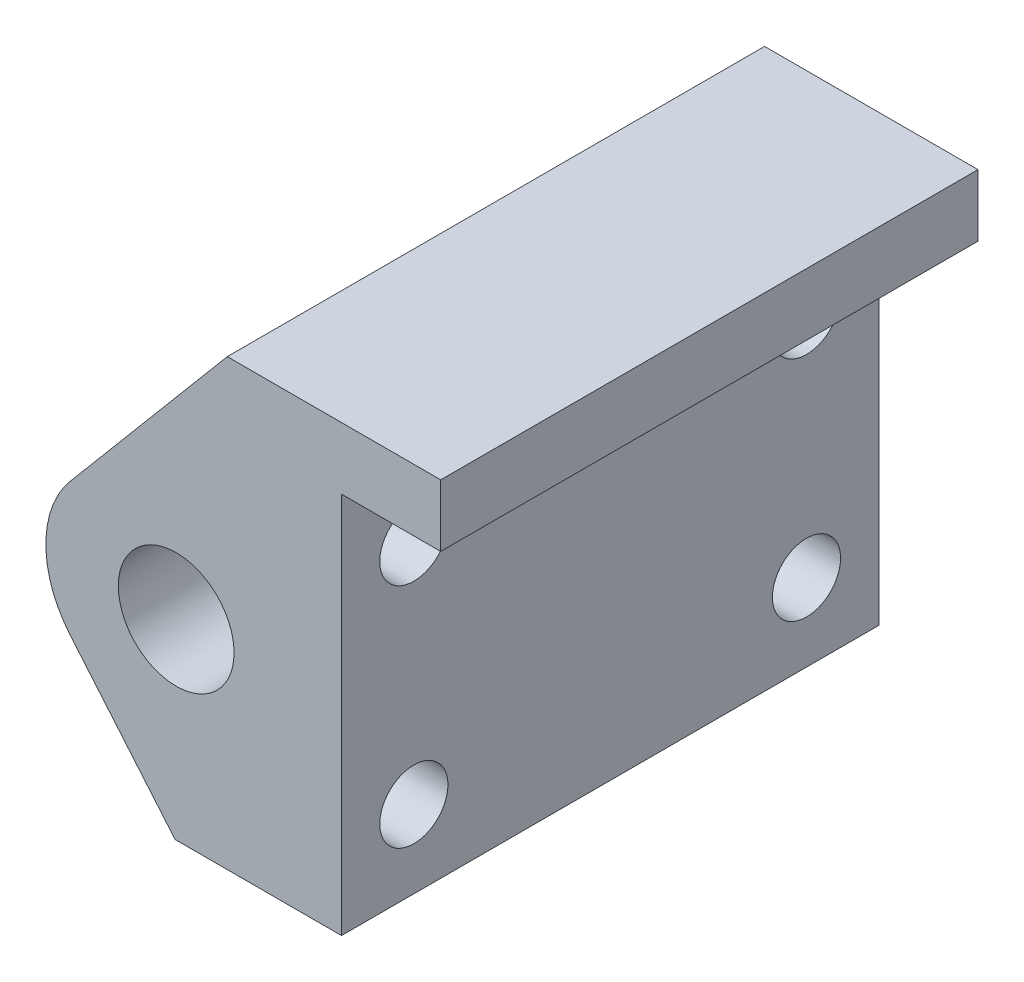
from build123d import *

# Parameters (mm, degrees)
SKETCH_1_R             = 2.8
EXTRUDE_1_DEPTH        = 26
SKETCH_2_R             = 1.65
CUT_EXTRUDE_2_DEPTH    = 43.555295324
CUT_EXTRUDE_2120_REACH = 46.4
SKETCH_4_W             = 26
SKETCH_4_H             = 3
CUT_EXTRUDE_3_REACH    = 44.395
SKETCH_7_W             = 26
SKETCH_7_H             = 3


with BuildPart() as part:
    # 草图1 → 凸台-拉伸1 (new body)
    with BuildSketch(Plane.XY):
        with BuildLine():
            Line((3, 6), (3, 24.5))
            Line((3, 24.5), (7.8, 24.5))
            Line((7.8, 24.5), (7.8, 30.5))
            Line((7.8, 30.5), (0, 30.5))
            Line((0, 30.5), (-10.13168569, 18.471060485))
            ThreePointArc((-10.13168569, 18.471060485), (-11.307451211, 15.25), (-10.13168569, 12.028939515))
            Line((-10.13168569, 12.028939515), (0, 0))
            Line((0, 0), (7.8, 0))
            Line((7.8, 0), (7.8, 6))
            Line((7.8, 6), (3, 6))
        make_face()
        with Locations(Location((-5, 15.25, 0), (0, 0, 180))):
            Circle(SKETCH_1_R, mode=Mode.SUBTRACT)
    extrude(amount=EXTRUDE_1_DEPTH)

    # 草图2 → 切除-拉伸2 (cut, through all)
    with BuildSketch(Plane(origin=(3, 0, 0), x_dir=(0, 0, -1), z_dir=(1, 0, 0))):
        with Locations((-3.5, 20.75)):
            Circle(SKETCH_2_R)
        with Locations((-22.5, 9.75)):
            Circle(SKETCH_2_R)
        with Locations((-22.5, 20.75)):
            Circle(SKETCH_2_R)
        with Locations((-3.5, 9.75)):
            Circle(SKETCH_2_R)
    extrude(amount=-CUT_EXTRUDE_2_DEPTH, mode=Mode.SUBTRACT)

    # 草图4 → Cut-Extrude 2120 (cut, up to next)
    with BuildSketch(Plane(origin=(7.8, 0, 0), x_dir=(0, 0, -1), z_dir=(1, 0, 0)), mode=Mode.PRIVATE) as cut_extrude_2120_sk1:
        with Locations((-13, 29)):
            Rectangle(SKETCH_4_W, SKETCH_4_H)
    cut_extrude_2120_tool1 = extrude(cut_extrude_2120_sk1.sketch, amount=-CUT_EXTRUDE_2120_REACH, mode=Mode.PRIVATE) & part.part
    # 草图4 → Cut-Extrude 2120 (cut, up to next)
    with BuildSketch(Plane(origin=(7.8, 0, 0), x_dir=(0, 0, -1), z_dir=(1, 0, 0)), mode=Mode.PRIVATE) as cut_extrude_2120_sk2:
        with Locations((-13, 1.5)):
            Rectangle(SKETCH_4_W, SKETCH_4_H)
    cut_extrude_2120_tool2 = extrude(cut_extrude_2120_sk2.sketch, amount=-CUT_EXTRUDE_2120_REACH, mode=Mode.PRIVATE) & part.part
    add(cut_extrude_2120_tool1.solids().sort_by_distance((7.8, 29, 13))[0], mode=Mode.SUBTRACT)
    add(cut_extrude_2120_tool2.solids().sort_by_distance((7.8, 1.5, 13))[0], mode=Mode.SUBTRACT)

    # 切除-拉伸3: up to this plane
    cut_extrude_3_end = Plane(origin=(0, 0, 26), z_dir=(0.7648468958435873, 0.6442120969978977, 0))
    # 草图7 → 切除-拉伸3 (cut, up to the surface)
    with BuildSketch(Plane(origin=(7.8, 0, 0), x_dir=(0, 0, -1), z_dir=(1, 0, 0)), mode=Mode.PRIVATE) as cut_extrude_3_sk1:
        with Locations((-13, 4.5)):
            Rectangle(SKETCH_7_W, SKETCH_7_H)
    cut_extrude_3_tool1 = split(extrude(cut_extrude_3_sk1.sketch, amount=-CUT_EXTRUDE_3_REACH, mode=Mode.PRIVATE), bisect_by=cut_extrude_3_end, keep=Keep.BOTH, mode=Mode.PRIVATE)
    add(cut_extrude_3_tool1.solids().sort_by_distance((7.8, 4.5, 13))[0], mode=Mode.SUBTRACT)


solid = part.part
